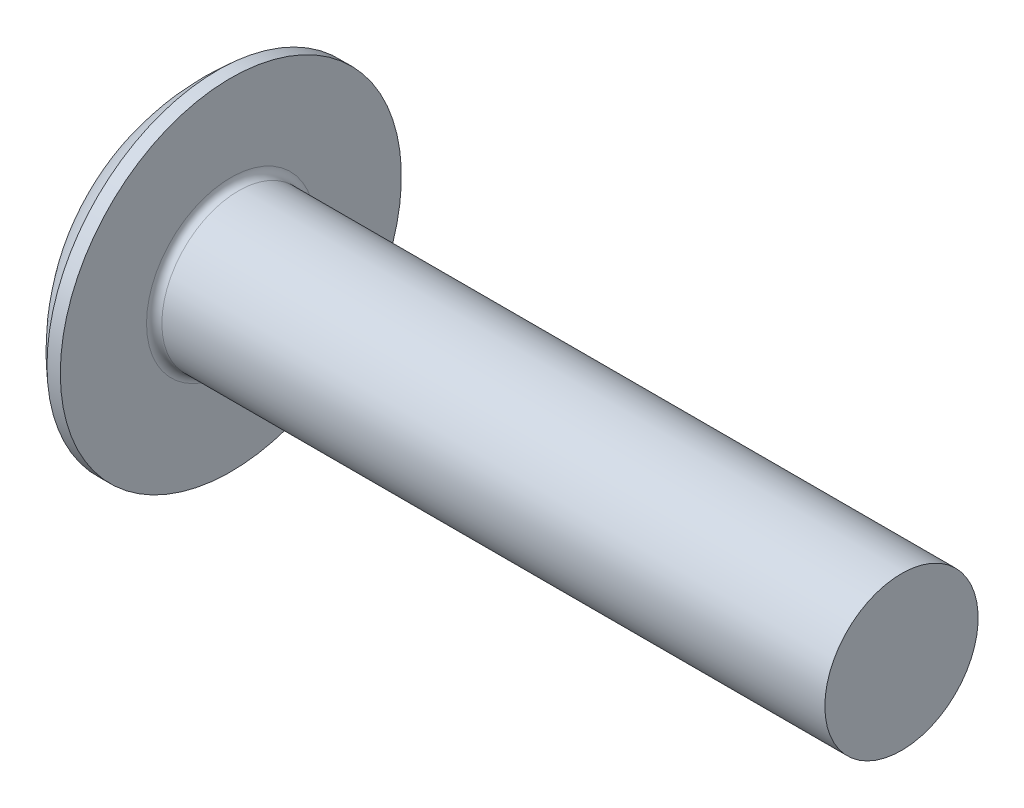
from build123d import *

# Parameters (mm, degrees)
FILLET1_R    = 0.4
RECPAT_COUNT = 2
RECPAT_ANGLE = 90


with BuildPart() as part:
    # BodySke → Base-Revolve (revolve)
    with BuildSketch(Plane.XY, mode=Mode.PRIVATE) as base_revolve_sk:
        with BuildLine():
            Line((4.8, 4), (4.8, 8.9))
            Line((4.8, 8.9), (4.105264982, 8.9))
            ThreePointArc((4.105264982, 8.9), (1.075772976, 4.900591816), (0, 0))
            Line((0, 0), (39.8, 0))
            Line((39.8, 0), (39.8, 4))
            Line((39.8, 4), (4.8, 4))
        make_face()
    revolve(base_revolve_sk.sketch.rotate(Axis((-25.4, 0, 0), (1, 0, 0)), 90), axis=Axis((-25.4, 0, 0), (1, 0, 0)))

    # Fillet1
    fillet1_edges = [part.edges().sort_by_distance(p)[0] for p in [
        (4.8, 0, -4),
    ]]
    fillet(fillet1_edges, radius=FILLET1_R)

    # Sketch3 → Recess section 0
    with BuildSketch(Plane(origin=(0, 0, 0), x_dir=(0, 0, -1), z_dir=(1, 0, 0))):
        with BuildLine():
            Line((0.71, -3.9), (-0.71, -3.9))
            Line((-0.71, -3.9), (-0.71, 3.9))
            Line((-0.71, 3.9), (0.71, 3.9))
            Line((0.71, 3.9), (0.71, -3.9))
        make_face()
    # Sketch4 → Recess section 1
    with BuildSketch(Plane(origin=(4.36, 0, 0), x_dir=(0, 0, -1), z_dir=(1, 0, 0))):
        with BuildLine():
            Line((0.71, -1.726184552), (-0.71, -1.726184552))
            Line((-0.71, -1.726184552), (-0.71, 1.726184552))
            Line((-0.71, 1.726184552), (0.71, 1.726184552))
            Line((0.71, 1.726184552), (0.71, -1.726184552))
        make_face()
    recess = loft(mode=Mode.SUBTRACT)

    # RecPat: Recess ×2 about axis
    recpat_axis = Axis((0, 0, 0), (1, 0, 0))
    for i in range(1, RECPAT_COUNT):
        add(recess.rotate(recpat_axis, i * RECPAT_ANGLE / (RECPAT_COUNT - 1)), mode=Mode.SUBTRACT)

    # RecCorSke → RecessCore (revolve, cut)
    with BuildSketch(Plane.XY, mode=Mode.PRIVATE) as recesscore_sk:
        Polygon((0, 0), (0, 1.5853809), (4.36, 1.2805), (4.776059671, 0), align=None)
    revolve(recesscore_sk.sketch.rotate(Axis((-3.175, 0, 0), (1, 0, 0)), 348.85798225), axis=Axis((-3.175, 0, 0), (1, 0, 0)), mode=Mode.SUBTRACT)


solid = part.part
